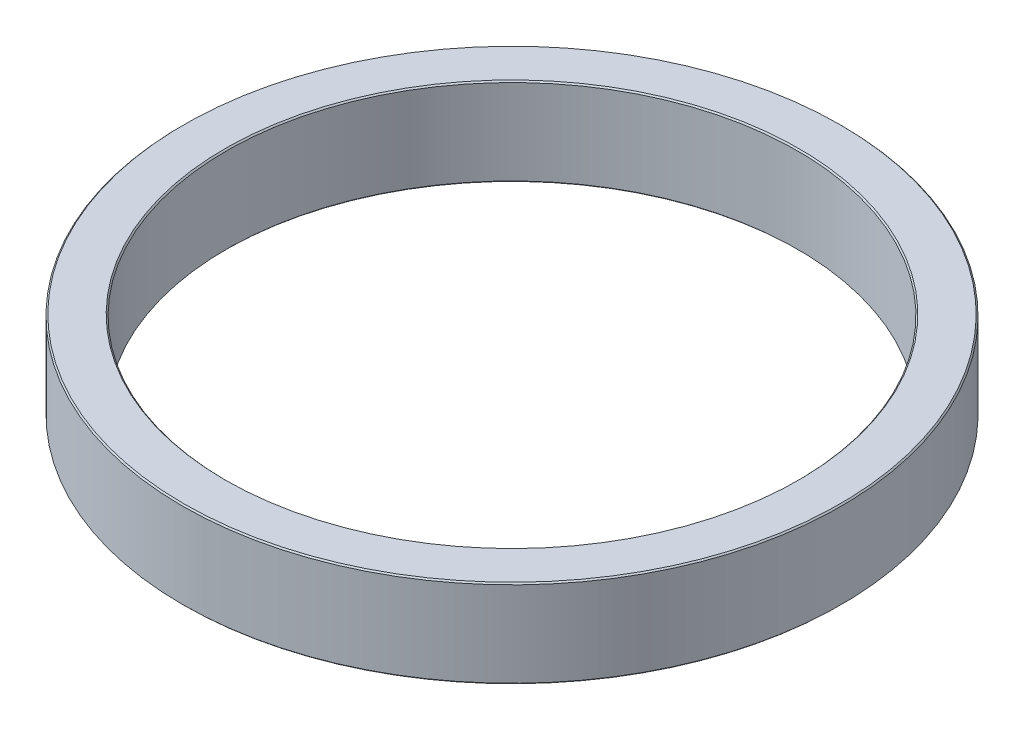
from build123d import *

# Parameters (mm, degrees)
SKETCH1_R           = 37.495
SKETCH1_R_2         = 32.5
BOSS_EXTRUDE1_DEPTH = 10
CHAMFER1_SIZE       = 0.15


with BuildPart() as part:
    # Sketch1 → Boss-Extrude1 (new body)
    with BuildSketch(Plane(origin=(0, 0, 0), x_dir=(1, 0, 0), z_dir=(0, 1, 0))):
        with Locations(Location((0, 0, 0), (0, 0, 270))):
            Circle(SKETCH1_R)
        with Locations(Location((0, 0, 0), (0, 0, 270))):
            Circle(SKETCH1_R_2, mode=Mode.SUBTRACT)
    extrude(amount=BOSS_EXTRUDE1_DEPTH)

    # Chamfer1
    chamfer1_edges = [part.edges().sort_by_distance(p)[0] for p in [
        (0, 0, -37.495),
        (0, 10, -37.495),
        (0, 0, -32.5),
        (0, 10, -32.5),
    ]]
    chamfer(chamfer1_edges, length=CHAMFER1_SIZE)


solid = part.part
